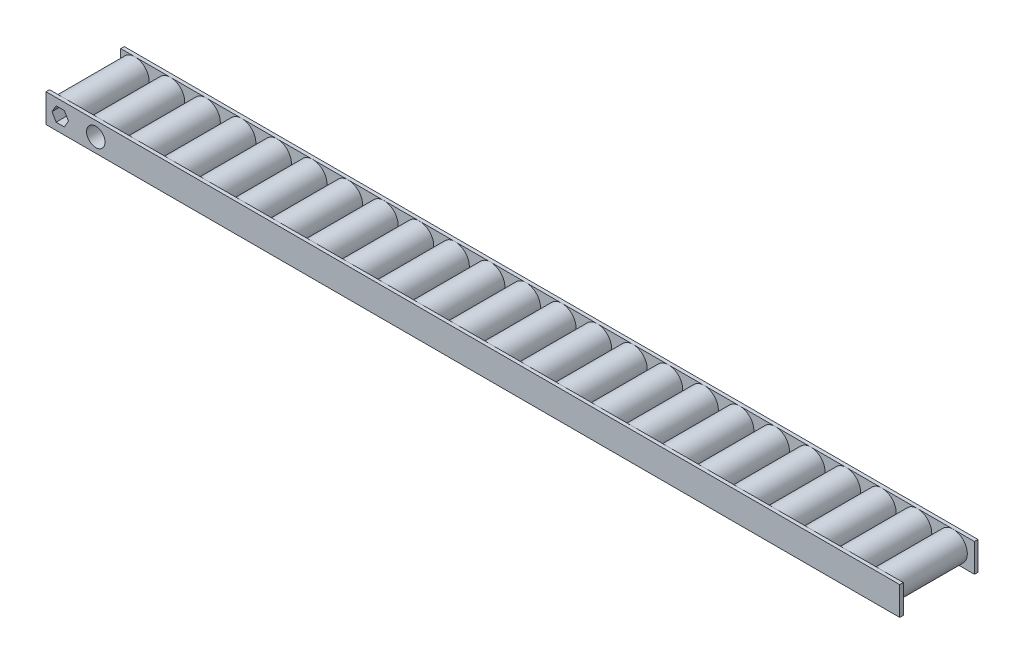
from build123d import *

# Parameters (mm, degrees)
SKETCH1_R           = 12.7
BOSS_EXTRUDE1_DEPTH = 63.5
LPATTERN1_COUNT     = 24
LPATTERN1_PITCH     = 31.75
SKETCH2_W           = 762
SKETCH2_H           = 25.4
BOSS_EXTRUDE2_DEPTH = 3.175
SKETCH3_R           = 8.255
CUT_EXTRUDE1_DEPTH  = 753.655832702


with BuildPart() as part:
    # Sketch1 → Boss-Extrude1 (new body)
    with BuildSketch(Plane.XY):
        Circle(SKETCH1_R)
    extrude(amount=BOSS_EXTRUDE1_DEPTH)


with BuildPart() as lpattern1_1:
    # LPattern1: pattern copy
    add(part.part.moved(Location(Vector(1, 0, 0) * (1 * LPATTERN1_PITCH))))


with BuildPart() as lpattern1_2:
    # LPattern1: pattern copy
    add(part.part.moved(Location(Vector(1, 0, 0) * (2 * LPATTERN1_PITCH))))


with BuildPart() as lpattern1_3:
    # LPattern1: pattern copy
    add(part.part.moved(Location(Vector(1, 0, 0) * (3 * LPATTERN1_PITCH))))


with BuildPart() as lpattern1_4:
    # LPattern1: pattern copy
    add(part.part.moved(Location(Vector(1, 0, 0) * (4 * LPATTERN1_PITCH))))


with BuildPart() as lpattern1_5:
    # LPattern1: pattern copy
    add(part.part.moved(Location(Vector(1, 0, 0) * (5 * LPATTERN1_PITCH))))


with BuildPart() as lpattern1_6:
    # LPattern1: pattern copy
    add(part.part.moved(Location(Vector(1, 0, 0) * (6 * LPATTERN1_PITCH))))


with BuildPart() as lpattern1_7:
    # LPattern1: pattern copy
    add(part.part.moved(Location(Vector(1, 0, 0) * (7 * LPATTERN1_PITCH))))


with BuildPart() as lpattern1_8:
    # LPattern1: pattern copy
    add(part.part.moved(Location(Vector(1, 0, 0) * (8 * LPATTERN1_PITCH))))


with BuildPart() as lpattern1_9:
    # LPattern1: pattern copy
    add(part.part.moved(Location(Vector(1, 0, 0) * (9 * LPATTERN1_PITCH))))


with BuildPart() as lpattern1_10:
    # LPattern1: pattern copy
    add(part.part.moved(Location(Vector(1, 0, 0) * (10 * LPATTERN1_PITCH))))


with BuildPart() as lpattern1_11:
    # LPattern1: pattern copy
    add(part.part.moved(Location(Vector(1, 0, 0) * (11 * LPATTERN1_PITCH))))


with BuildPart() as lpattern1_12:
    # LPattern1: pattern copy
    add(part.part.moved(Location(Vector(1, 0, 0) * (12 * LPATTERN1_PITCH))))


with BuildPart() as lpattern1_13:
    # LPattern1: pattern copy
    add(part.part.moved(Location(Vector(1, 0, 0) * (13 * LPATTERN1_PITCH))))


with BuildPart() as lpattern1_14:
    # LPattern1: pattern copy
    add(part.part.moved(Location(Vector(1, 0, 0) * (14 * LPATTERN1_PITCH))))


with BuildPart() as lpattern1_15:
    # LPattern1: pattern copy
    add(part.part.moved(Location(Vector(1, 0, 0) * (15 * LPATTERN1_PITCH))))


with BuildPart() as lpattern1_16:
    # LPattern1: pattern copy
    add(part.part.moved(Location(Vector(1, 0, 0) * (16 * LPATTERN1_PITCH))))


with BuildPart() as lpattern1_17:
    # LPattern1: pattern copy
    add(part.part.moved(Location(Vector(1, 0, 0) * (17 * LPATTERN1_PITCH))))


with BuildPart() as lpattern1_18:
    # LPattern1: pattern copy
    add(part.part.moved(Location(Vector(1, 0, 0) * (18 * LPATTERN1_PITCH))))


with BuildPart() as lpattern1_19:
    # LPattern1: pattern copy
    add(part.part.moved(Location(Vector(1, 0, 0) * (19 * LPATTERN1_PITCH))))


with BuildPart() as lpattern1_20:
    # LPattern1: pattern copy
    add(part.part.moved(Location(Vector(1, 0, 0) * (20 * LPATTERN1_PITCH))))


with BuildPart() as lpattern1_21:
    # LPattern1: pattern copy
    add(part.part.moved(Location(Vector(1, 0, 0) * (21 * LPATTERN1_PITCH))))


with BuildPart() as lpattern1_22:
    # LPattern1: pattern copy
    add(part.part.moved(Location(Vector(1, 0, 0) * (22 * LPATTERN1_PITCH))))


with BuildPart() as lpattern1_23:
    # LPattern1: pattern copy
    add(part.part.moved(Location(Vector(1, 0, 0) * (23 * LPATTERN1_PITCH))))


with BuildPart() as part_1:
    add(part.part)

    add(lpattern1_1.part)  # Boss-Extrude2 merges LPattern1_1

    add(lpattern1_2.part)  # Boss-Extrude2 merges LPattern1_2

    add(lpattern1_3.part)  # Boss-Extrude2 merges LPattern1_3

    add(lpattern1_4.part)  # Boss-Extrude2 merges LPattern1_4

    add(lpattern1_5.part)  # Boss-Extrude2 merges LPattern1_5

    add(lpattern1_6.part)  # Boss-Extrude2 merges LPattern1_6

    add(lpattern1_7.part)  # Boss-Extrude2 merges LPattern1_7

    add(lpattern1_8.part)  # Boss-Extrude2 merges LPattern1_8

    add(lpattern1_9.part)  # Boss-Extrude2 merges LPattern1_9

    add(lpattern1_10.part)  # Boss-Extrude2 merges LPattern1_10

    add(lpattern1_11.part)  # Boss-Extrude2 merges LPattern1_11

    add(lpattern1_12.part)  # Boss-Extrude2 merges LPattern1_12

    add(lpattern1_13.part)  # Boss-Extrude2 merges LPattern1_13

    add(lpattern1_14.part)  # Boss-Extrude2 merges LPattern1_14
    # Sketch2 → Boss-Extrude2 (add)
    with BuildSketch(Plane.XY.offset(63.5)):
        with Locations((368.3, 0)):
            Rectangle(SKETCH2_W, SKETCH2_H)
    boss_extrude2 = extrude(amount=BOSS_EXTRUDE2_DEPTH)

    # Mirror1: Boss-Extrude2 across plane
    add(boss_extrude2.mirror(Plane.XY.offset(31.75)))

    # Sketch3 → Cut-Extrude1 (cut, through all)
    with BuildSketch(Plane.XY.offset(66.675)):
        with Locations((31.75, 0)):
            Circle(SKETCH3_R)
        Polygon((7.332348419, 0), (3.666174209, 6.35), (-3.666174209, 6.35), (-7.332348419, 0), (-3.666174209, -6.35), (3.666174209, -6.35), align=None)
    extrude(amount=-CUT_EXTRUDE1_DEPTH, mode=Mode.SUBTRACT)


solid = Compound([lpattern1_15.part, lpattern1_16.part, lpattern1_17.part, lpattern1_18.part, lpattern1_19.part, lpattern1_20.part, lpattern1_21.part, lpattern1_22.part, lpattern1_23.part, part_1.part])
